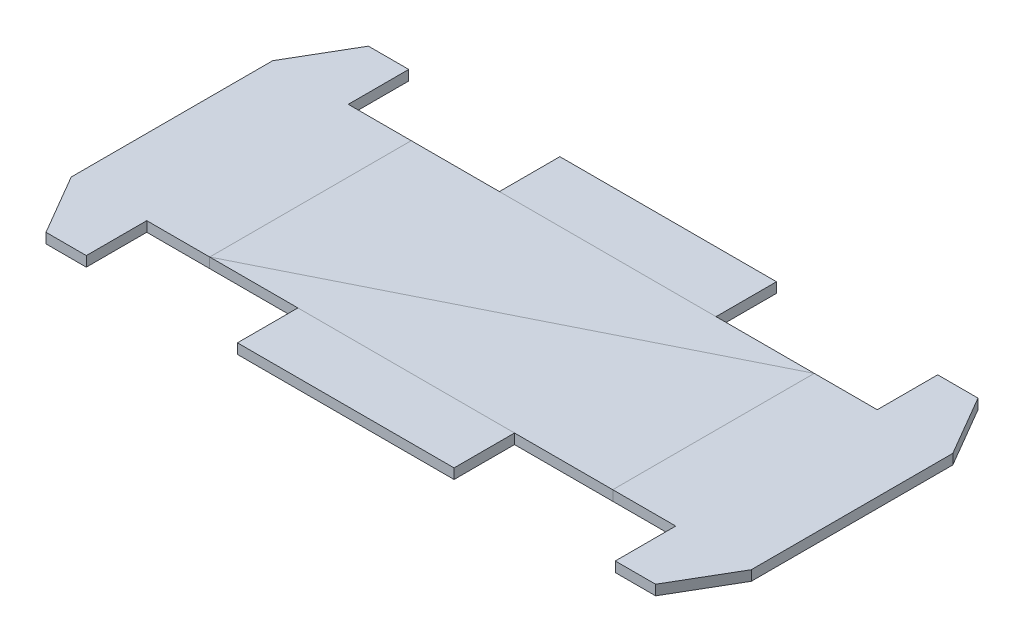
from build123d import *

# Parameters (mm, degrees)
SKETCH1_W             = 200
SKETCH1_H             = 100
BOSS_EXTRUDE1_DEPTH   = 5
SKETCH3_W             = 200
SKETCH3_H             = 5
BOSS_EXTRUDE2_DEPTH   = 50
SKETCH4_W             = 100
SKETCH4_H             = 5
BOSS_EXTRUDE3_DEPTH   = 100
BOSS_EXTRUDE4_DEPTH   = 5
SKETCH6_W             = 107.5
SKETCH6_H             = 30
BOSS_EXTRUDE4_2_DEPTH = 5
BOSS_EXTRUDE4_3_DEPTH = 5
BOSS_EXTRUDE4_4_DEPTH = 5


with BuildPart() as part:
    # Sketch1 → Boss-Extrude1 (new body)
    with BuildSketch(Plane(origin=(0, 0, 0), x_dir=(1, 0, 0), z_dir=(0, 1, 0))):
        Rectangle(SKETCH1_W, SKETCH1_H)
    extrude(amount=BOSS_EXTRUDE1_DEPTH)

    # Sketch3 → Boss-Extrude2 (add, symmetric)
    with BuildSketch(Plane.XY):
        with Locations((0, 2.5)):
            Rectangle(SKETCH3_W, SKETCH3_H)
    extrude(amount=BOSS_EXTRUDE2_DEPTH, both=True)


with BuildPart() as body_2:
    # Sketch4 → Boss-Extrude3 (new, symmetric)
    with BuildSketch(Plane(origin=(0, 0, 0), x_dir=(0, 0, -1), z_dir=(1, 0, 0))):
        with Locations((0, 2.5)):
            Rectangle(SKETCH4_W, SKETCH4_H)
    extrude(amount=BOSS_EXTRUDE3_DEPTH, both=True)


with BuildPart() as body_3:
    # Sketch6 → Boss-Extrude4 (new body)
    with BuildSketch(Plane(origin=(0, 0, 0), x_dir=(1, 0, 0), z_dir=(0, 1, 0))):
        Polygon((-100, 50), (-131.25, 50), (-131.25, 80), (-151.25, 80), (-168.75, 50), (-168.75, -50), (-151.25, -80), (-131.25, -80), (-131.25, -50), (-100, -50), align=None)
    extrude(amount=BOSS_EXTRUDE4_DEPTH)


with BuildPart() as body_4:
    # Sketch6 → Boss-Extrude4 2 (new body)
    with BuildSketch(Plane(origin=(0, 0, 0), x_dir=(1, 0, 0), z_dir=(0, 1, 0))):
        with Locations((-2.5, -65)):
            Rectangle(SKETCH6_W, SKETCH6_H)
    extrude(amount=BOSS_EXTRUDE4_2_DEPTH)


with BuildPart() as body_5:
    # Sketch6 → Boss-Extrude4 3 (new body)
    with BuildSketch(Plane(origin=(0, 0, 0), x_dir=(1, 0, 0), z_dir=(0, 1, 0))):
        Polygon((100, 50), (131.25, 50), (131.25, 80), (151.25, 80), (168.75, 50), (168.75, -50), (151.25, -80), (131.25, -80), (131.25, -50), (100, -50), align=None)
    extrude(amount=BOSS_EXTRUDE4_3_DEPTH)


with BuildPart() as body_6:
    # Sketch6 → Boss-Extrude4 4 (new body)
    with BuildSketch(Plane(origin=(0, 0, 0), x_dir=(1, 0, 0), z_dir=(0, 1, 0))):
        with Locations((-2.5, 65)):
            Rectangle(SKETCH6_W, SKETCH6_H)
    extrude(amount=BOSS_EXTRUDE4_4_DEPTH)


solid = Compound([part.part, body_2.part, body_3.part, body_4.part, body_5.part, body_6.part])
